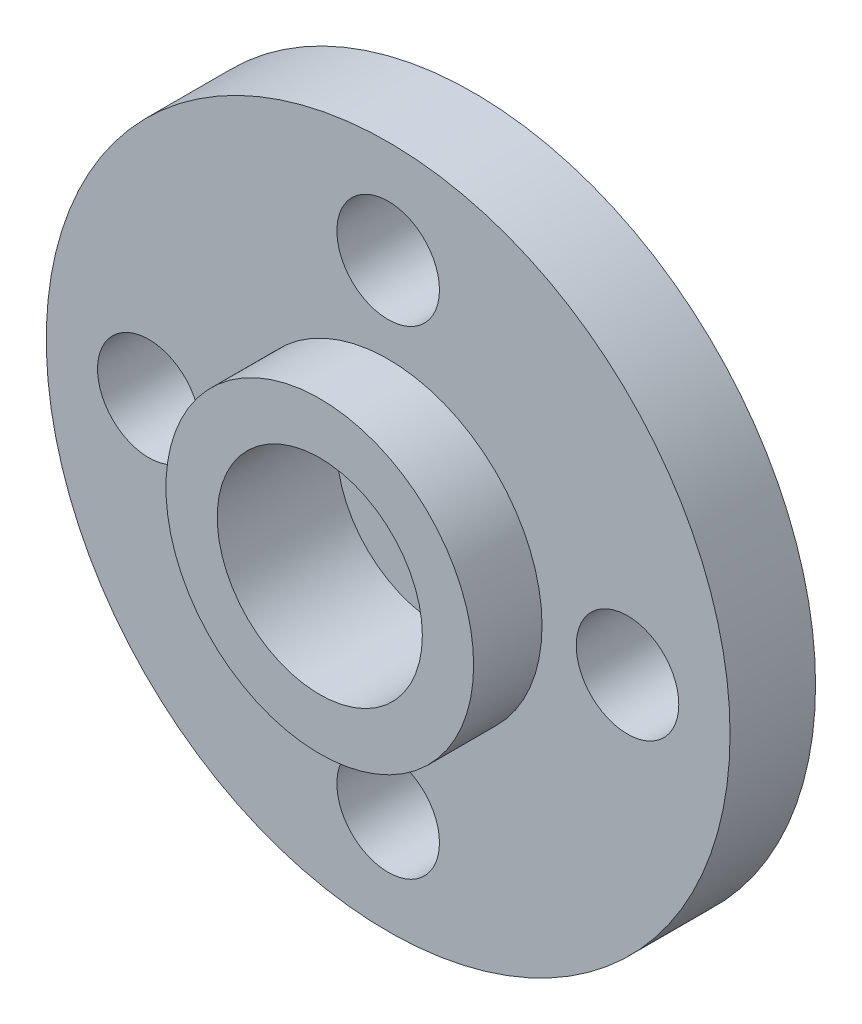
from build123d import *

# Parameters (mm, degrees)
SKETCH1_R             = 10
EXTRUDE_365_DEPTH     = 2.5
SKETCH2_R             = 4.5
SKETCH2_R_2           = 3
EXTRUDE_479_DEPTH     = 2
SKETCH3_R             = 1.5
CUT_EXTRUDE_573_DEPTH = 13
SKETCH4_R             = 1.5
CUT_EXTRUDE_802_DEPTH = 13
CUT_EXTRUDE_START     = -3.5
SKETCH5_R             = 3
CUT_EXTRUDE_911_DEPTH = 3.5


with BuildPart() as part:
    # Sketch1 → Extrude 365 (new body)
    with BuildSketch(Plane.XY):
        Circle(SKETCH1_R)
    extrude(amount=EXTRUDE_365_DEPTH)

    # Sketch2 → Extrude 479 (add)
    with BuildSketch(Plane.XY.offset(2.5)):
        Circle(SKETCH2_R)
        Circle(SKETCH2_R_2, mode=Mode.SUBTRACT)
    extrude(amount=EXTRUDE_479_DEPTH)

    # Sketch3 → Cut-Extrude 573 (cut)
    with BuildSketch(Plane.XY.offset(2.5)):
        Circle(SKETCH3_R)
    extrude(amount=-CUT_EXTRUDE_573_DEPTH, mode=Mode.SUBTRACT)

    # Sketch4 → Cut-Extrude 802 (cut)
    with BuildSketch(Plane.XY.offset(2.5)):
        with Locations((0, 7)):
            Circle(SKETCH4_R)
        with Locations((7, 0)):
            Circle(SKETCH4_R)
        with Locations((0, -7)):
            Circle(SKETCH4_R)
        with Locations((-7, 0)):
            Circle(SKETCH4_R)
    extrude(amount=-CUT_EXTRUDE_802_DEPTH, mode=Mode.SUBTRACT)

    # Sketch5 → Cut-Extrude 911 (cut)
    with BuildSketch(Plane.XY.offset(4.5).offset(CUT_EXTRUDE_START)):
        Circle(SKETCH5_R)
    extrude(amount=CUT_EXTRUDE_911_DEPTH, mode=Mode.SUBTRACT)


solid = part.part
